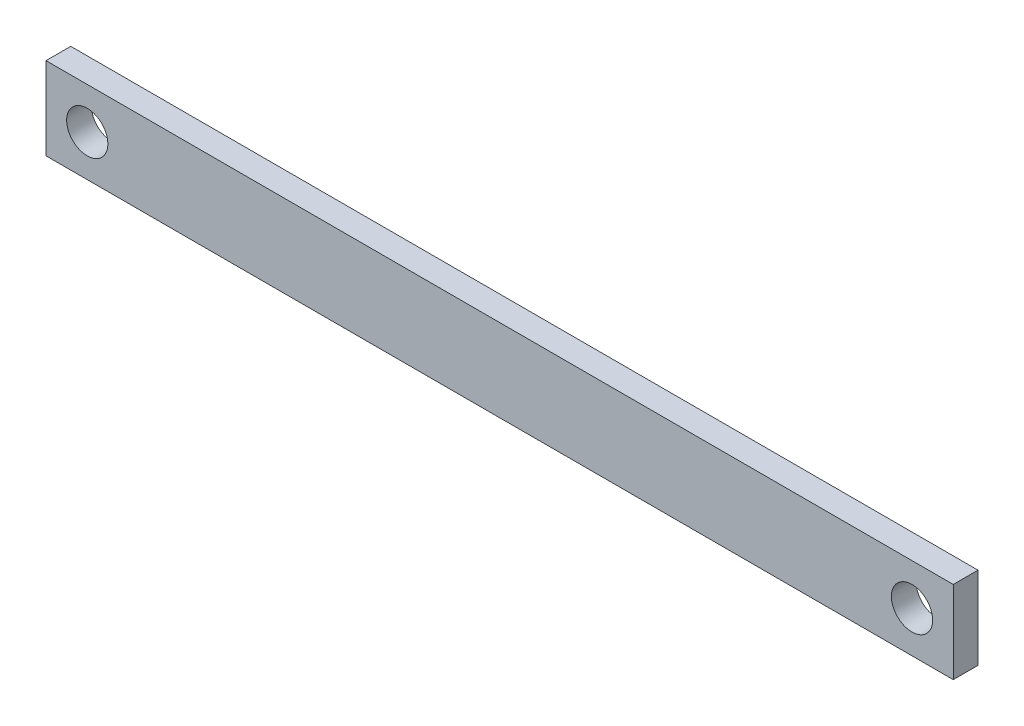
from build123d import *

# Parameters (mm, degrees)
SKETCH_1_W      = 110
SKETCH_1_H      = 10
SKETCH_1_R      = 2.5
EXTRUDE_1_DEPTH = 3


with BuildPart() as part:
    # 草圖1 → 填料-伸長1 (new body)
    with BuildSketch(Plane.XY):
        Rectangle(SKETCH_1_W, SKETCH_1_H)
        with Locations((-50, 0)):
            Circle(SKETCH_1_R, mode=Mode.SUBTRACT)
        with Locations((50, 0)):
            Circle(SKETCH_1_R, mode=Mode.SUBTRACT)
    extrude(amount=EXTRUDE_1_DEPTH)


solid = part.part
